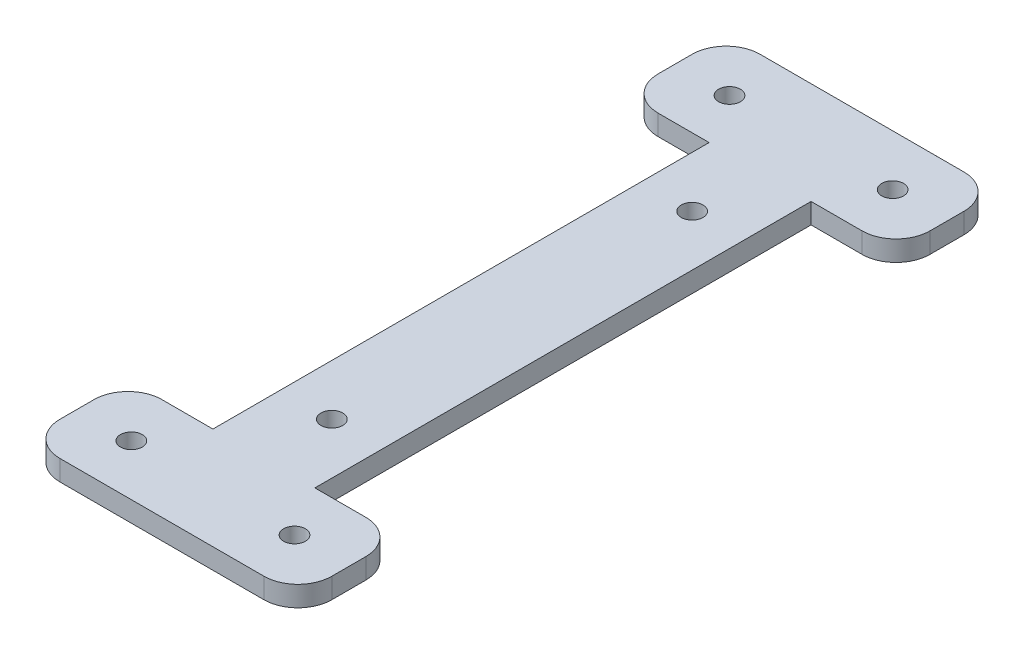
from build123d import *

# Parameters (mm, degrees)
SKETCH1_R           = 1.6
SKETCH1_W           = 15
SKETCH1_H           = 73
SKETCH1_W_2         = 40
SKETCH1_H_2         = 15
BOSS_EXTRUDE1_DEPTH = 3
FILLET1_R           = 5


with BuildPart() as part:
    # Sketch1 → Boss-Extrude1 (new body)
    # profile 1 of 3: a face of its own
    with BuildSketch(Plane(origin=(0, 0, 0), x_dir=(1, 0, 0), z_dir=(0, 1, 0))):
        Polygon((0, 88), (12.5, 88), (27.5, 88), (40, 88), (40, 103), (0, 103), align=None)
        with Locations(Location((8, 95.5, 0), (0, 0, 270))):
            Circle(SKETCH1_R, mode=Mode.SUBTRACT)
        with Locations(Location((32, 95.5, 0), (0, 0, 270))):
            Circle(SKETCH1_R, mode=Mode.SUBTRACT)
    # profile 2 of 3: a face of its own
    with BuildSketch(Plane(origin=(0, 0, 0), x_dir=(1, 0, 0), z_dir=(0, 1, 0))):
        with Locations((20, 51.5)):
            Rectangle(SKETCH1_W, SKETCH1_H)
        with Locations(Location((20, 25, 0), (0, 0, 270))):
            Circle(SKETCH1_R, mode=Mode.SUBTRACT)
        with Locations(Location((20, 78, 0), (0, 0, 270))):
            Circle(SKETCH1_R, mode=Mode.SUBTRACT)
    # profile 3 of 3: a face of its own
    with BuildSketch(Plane(origin=(0, 0, 0), x_dir=(1, 0, 0), z_dir=(0, 1, 0))):
        with Locations((20, 7.5)):
            Rectangle(SKETCH1_W_2, SKETCH1_H_2)
        with Locations(Location((8, 7.5, 0), (0, 0, 270))):
            Circle(SKETCH1_R, mode=Mode.SUBTRACT)
        with Locations(Location((32, 7.5, 0), (0, 0, 270))):
            Circle(SKETCH1_R, mode=Mode.SUBTRACT)
    extrude(amount=BOSS_EXTRUDE1_DEPTH)

    # Fillet1
    fillet1_edges = [part.edges().sort_by_distance(p)[0] for p in [
        (40, 1.5, -88),
        (40, 1.5, -15),
        (40, 1.5, 0),
        (0, 1.5, 0),
        (0, 1.5, -15),
        (0, 1.5, -88),
        (0, 1.5, -103),
        (40, 1.5, -103),
    ]]
    fillet(fillet1_edges, radius=FILLET1_R)


solid = part.part
